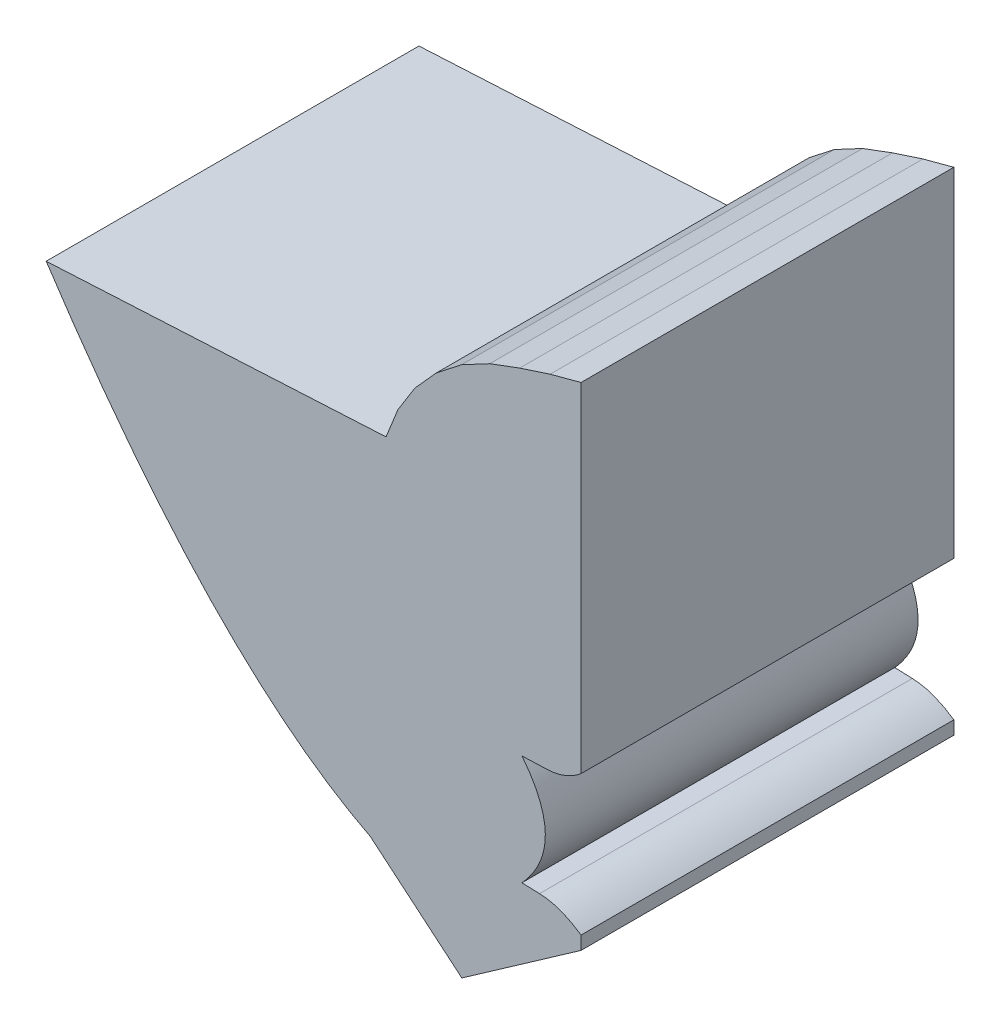
from build123d import *

# Parameters (mm, degrees)
CROQUIS_BASE_DEPTH             = 6.9937
LENTE_PPAL_1_REACH             = 29.176
LENTE_PPAL_1_DIRECTION_2_REACH = 29.176
LENTE_PPAL_2_DEPTH             = 28.175928622
LENTE_PPAL_2_DEPTH_BACK        = 28.175928622
CROQUIS9_3_OUTSIDE_W           = 30.065
CROQUIS9_3_OUTSIDE_H           = 25.937
LENTE_START                    = -6.9937
LENTE_FRONTAL_DEPTH            = 13.9874
LENTE_START_2                  = -6.993701
LENTE_TRASERA_DEPTH            = 13.987402


with BuildPart() as part:
    # Croquis1 → croquis base (new, symmetric)
    with BuildSketch(Plane.XY):
        with BuildLine():
            Line((-8.981845695, 12.608155172), (-23.035921146, 11.871612288))
            Line((-23.035921146, 11.871612288), (-23.035921146, 11.54013782))
            ThreePointArc((-23.035921146, 11.54013782), (-20.949684518, 9.582335705), (-18.945192114, 7.540918896))
            add(Edge.make_bspline(
                [(-18.945192114, 7.540918896), (-10.215008384, -3.697644103), (-2.846604825, -5.059081104)],
                knots=[0.497667241, 0.497667241, 0.497667241, 0.49955428, 0.49955428, 0.49955428], degree=2, weights=[1, 1, 1]))
            add(Edge.make_bspline(
                [(-2.846604825, -5.059081104), (-2.498165198, -4.87297933), (-2.177330418, -4.684462446)],
                knots=[0.498812075, 0.498812075, 0.498812075, 0.498911556, 0.498911556, 0.498911556], degree=2, weights=[1, 1, 1]))
            Line((-2.177330418, -4.684462446), (-2.177330418, 6.186438919))
            add(Edge.make_bspline(
                [(-2.177330418, 6.186438919), (-4.063319702, 8.141636997), (-6.994875026, 10.477389992)],
                knots=[0.50138293, 0.50138293, 0.50138293, 0.502013312, 0.502013312, 0.502013312], degree=2, weights=[1, 1, 1]))
            Line((-6.994875026, 10.477389992), (-8.981845695, 12.608155172))
        make_face()
    extrude(amount=CROQUIS_BASE_DEPTH, both=True)

    # lente ppal 1: up to this face of the body (flat: up to its plane)
    lente_ppal_1_end = Plane(part.part.faces().sort_by_distance((-10.153546236, 5.159655325, 6.9937))[0])
    # Croquis9 → lente ppal 1 (add, up to the picked face)
    with BuildSketch(Plane.XY, mode=Mode.PRIVATE) as lente_ppal_1_sk1:
        with BuildLine():
            add(Edge.make_bspline(
                [(-2.177330418, -4.388282022), (-10.4130765, -4.994158739), (-19.969359014, 9.493765032)],
                knots=[0, 0, 0, 1, 1, 1], degree=2))
            Line((-19.969359014, 9.493765032), (-10.309820395, 10))
            Line((-10.309820395, 10), (-2.177330418, 6.082860828))
            Line((-2.177330418, 6.082860828), (-2.177330418, 2.424232079))
            add(Edge.make_bspline(
                [(-2.177330418, 2.424232079), (-0.304369248, 0.128042884), (-2.177330418, -1.840420572)],
                knots=[0, 0, 0, 1, 1, 1], degree=2))
            Line((-2.177330418, -1.840420572), (-2.177330418, -4.388282022))
        make_face()
    lente_ppal_1_tool1 = split(extrude(lente_ppal_1_sk1.sketch, amount=LENTE_PPAL_1_REACH, mode=Mode.PRIVATE), bisect_by=lente_ppal_1_end, keep=Keep.BOTH, mode=Mode.PRIVATE)
    add(lente_ppal_1_tool1.solids().sort_by(Axis((-9.106368, 3.599172, 0), (0, 0, 1)))[0])

    # lente ppal 1 direction 2: up to this face of the body (flat: up to its plane)
    lente_ppal_1_direction_2_end = Plane(part.part.faces().sort_by_distance((-10.153546236, 5.159655325, -6.9937))[0])
    # Croquis9 → lente ppal 1 direction 2 (add, up to the picked face)
    with BuildSketch(Plane.XY, mode=Mode.PRIVATE) as lente_ppal_1_direction_2_sk1:
        with BuildLine():
            add(Edge.make_bspline(
                [(-2.177330418, -4.388282022), (-10.4130765, -4.994158739), (-19.969359014, 9.493765032)],
                knots=[0, 0, 0, 1, 1, 1], degree=2))
            Line((-19.969359014, 9.493765032), (-10.309820395, 10))
            Line((-10.309820395, 10), (-2.177330418, 6.082860828))
            Line((-2.177330418, 6.082860828), (-2.177330418, 2.424232079))
            add(Edge.make_bspline(
                [(-2.177330418, 2.424232079), (-0.304369248, 0.128042884), (-2.177330418, -1.840420572)],
                knots=[0, 0, 0, 1, 1, 1], degree=2))
            Line((-2.177330418, -1.840420572), (-2.177330418, -4.388282022))
        make_face()
    lente_ppal_1_direction_2_tool1 = split(extrude(lente_ppal_1_direction_2_sk1.sketch, amount=-LENTE_PPAL_1_DIRECTION_2_REACH, mode=Mode.PRIVATE), bisect_by=lente_ppal_1_direction_2_end, keep=Keep.BOTH, mode=Mode.PRIVATE)
    add(lente_ppal_1_direction_2_tool1.solids().sort_by(Axis((-9.106368, 3.599172, 0), (0, 0, -1)))[0])

    # Croquis9<3> outside → lente ppal 2 (cut, two sides: drawn at the far end of the back side and taken through both)
    with BuildSketch(Plane.XY.offset(-LENTE_PPAL_2_DEPTH_BACK)):
        with Locations((-12.1385, 3.7745)):
            Rectangle(CROQUIS9_3_OUTSIDE_W, CROQUIS9_3_OUTSIDE_H)
        with BuildLine():
            Line((-2.177330418, -1.840420572), (-2.177330418, -4.388282022))
            add(Edge.make_bspline(
                [(-2.177330418, -4.388282022), (-10.4130765, -4.994158739), (-19.969359014, 9.493765032)],
                knots=[0, 0, 0, 1, 1, 1], degree=2))
            Line((-19.969359014, 9.493765032), (-10.309820395, 10))
            Line((-10.309820395, 10), (-2.177330418, 6.082860828))
            Line((-2.177330418, 6.082860828), (-2.177330418, 2.424232079))
            add(Edge.make_bspline(
                [(-2.177330418, 2.424232079), (-0.304369248, 0.128042884), (-2.177330418, -1.840420572)],
                knots=[0, 0, 0, 1, 1, 1], degree=2))
        make_face(mode=Mode.SUBTRACT)
    extrude(amount=LENTE_PPAL_2_DEPTH + LENTE_PPAL_2_DEPTH_BACK, mode=Mode.SUBTRACT)

    # Croquis8 → lente frontal (add)
    with BuildSketch(Plane.XY.offset(LENTE_START)):
        with BuildLine():
            Line((0.1, 2.877673418), (0.1, 15.587903347))
            Line((0.1, 15.587903347), (-1.059110992, 15.277320493))
            Line((-1.059110992, 15.277320493), (-2.200378811, 14.9065001))
            Line((-2.200378811, 14.9065001), (-3.324385438, 14.486251242))
            Line((-3.324385438, 14.486251242), (-4.38392255, 13.922885367))
            Line((-4.38392255, 13.922885367), (-5.329535454, 13.184091597))
            Line((-5.329535454, 13.184091597), (-6.132492182, 12.292317806))
            Line((-6.132492182, 12.292317806), (-6.768395299, 11.274660091))
            Line((-6.768395299, 11.274660091), (-7.217923211, 10.162039465))
            Line((-7.217923211, 10.162039465), (-10.309820395, 10))
            Line((-10.309820395, 10), (-2.177330418, 2.342487007))
            Line((-2.177330418, 2.342487007), (-1.190501641, 2.376947827))
            add(Edge.make_bspline(
                [(-1.190501641, 2.376947827), (-0.463368169, 2.402339888), (0.1, 2.877673418)],
                knots=[0, 0, 0, 1, 1, 1], degree=2))
        make_face()
    extrude(amount=LENTE_FRONTAL_DEPTH)

    # Croquis11 → lente trasera (add)
    with BuildSketch(Plane.XY.offset(LENTE_START_2)):
        with BuildLine():
            Line((0.1, -2.367807069), (0.1, -2.867807069))
            Line((0.1, -2.867807069), (-4.373235091, -6))
            Line((-4.373235091, -6), (-9.72117641, -1.512544411))
            Line((-9.72117641, -1.512544411), (-1.458120605, -1.801096678))
            add(Edge.make_bspline(
                [(-1.458120605, -1.801096678), (-0.674591915, -1.828458103), (0.1, -2.367807069)],
                knots=[0, 0, 0, 1, 1, 1], degree=2))
        make_face()
    extrude(amount=LENTE_TRASERA_DEPTH)


solid = part.part
